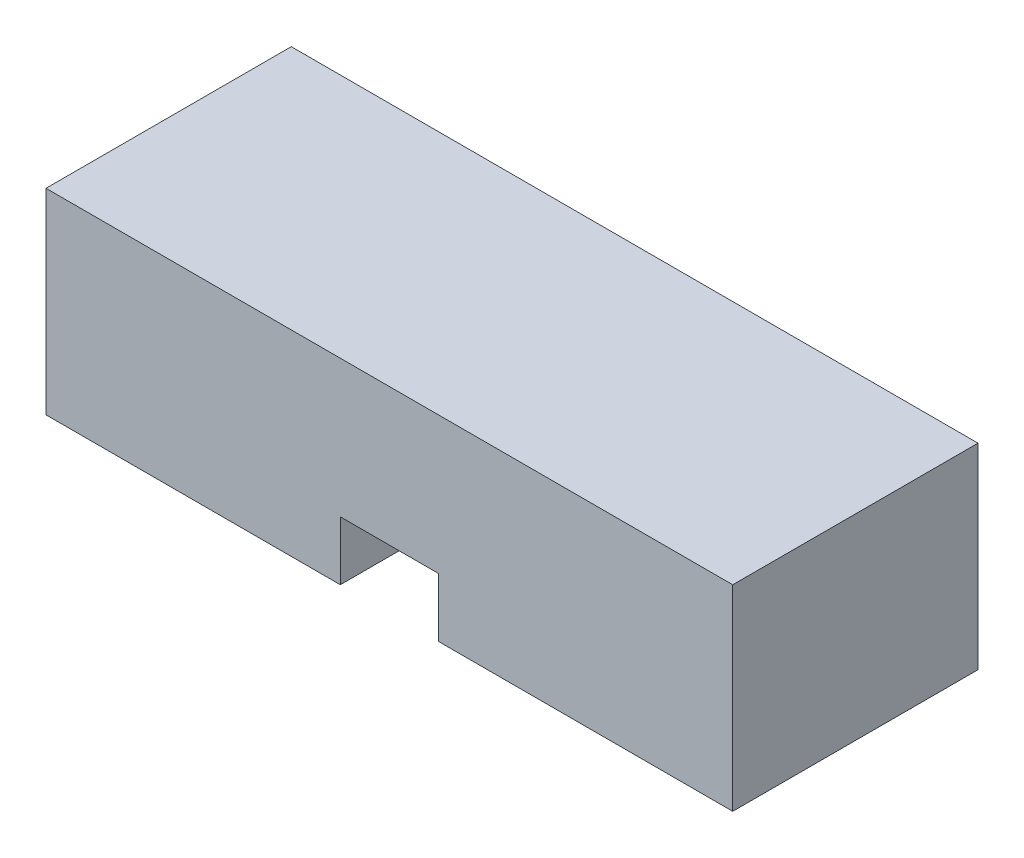
from build123d import *

# Parameters (mm, degrees)
SKETCH1_W           = 70
SKETCH1_H           = 25
BOSS_EXTRUDE1_DEPTH = 20
SKETCH2_R           = 7.95
CUT_EXTRUDE1_DEPTH  = 7
SKETCH3_W           = 10
SKETCH3_H           = 25
CUT_EXTRUDE2_DEPTH  = 4
SKETCH7_W           = 10
SKETCH7_H           = 9
CUT_EXTRUDE3_DEPTH  = 6
FILLET1_R           = 3.2


with BuildPart() as part:
    # Sketch1 → Boss-Extrude1 (new body)
    with BuildSketch(Plane(origin=(0, 0, 0), x_dir=(1, 0, 0), z_dir=(0, 1, 0))):
        Rectangle(SKETCH1_W, SKETCH1_H)
    extrude(amount=-BOSS_EXTRUDE1_DEPTH)

    # Sketch2 → Cut-Extrude1 (cut)
    with BuildSketch(Plane.XZ.offset(20)):
        with Locations(Location((-10.95, -2.198838129, 0), (0, 0, 270))):
            Circle(SKETCH2_R)
        with Locations(Location((10.95, -2.198838129, 0), (0, 0, 270))):
            Circle(SKETCH2_R)
    extrude(amount=-CUT_EXTRUDE1_DEPTH, mode=Mode.SUBTRACT)

    # Sketch3 → Cut-Extrude2 (cut)
    with BuildSketch(Plane.XZ.offset(20)):
        Rectangle(SKETCH3_W, SKETCH3_H)
    extrude(amount=-CUT_EXTRUDE2_DEPTH, mode=Mode.SUBTRACT)

    # Sketch7 → Cut-Extrude3 (cut)
    with BuildSketch(Plane.XZ.offset(20)):
        with Locations((0, 8)):
            Rectangle(SKETCH7_W, SKETCH7_H)
    extrude(amount=-CUT_EXTRUDE3_DEPTH, mode=Mode.SUBTRACT)

    # Fillet1
    fillet1_edges = [part.edges().sort_by_distance(p)[0] for p in [
        (5, -15, 3.5),
        (-5, -15, 3.5),
    ]]
    fillet(fillet1_edges, radius=FILLET1_R)


solid = part.part
